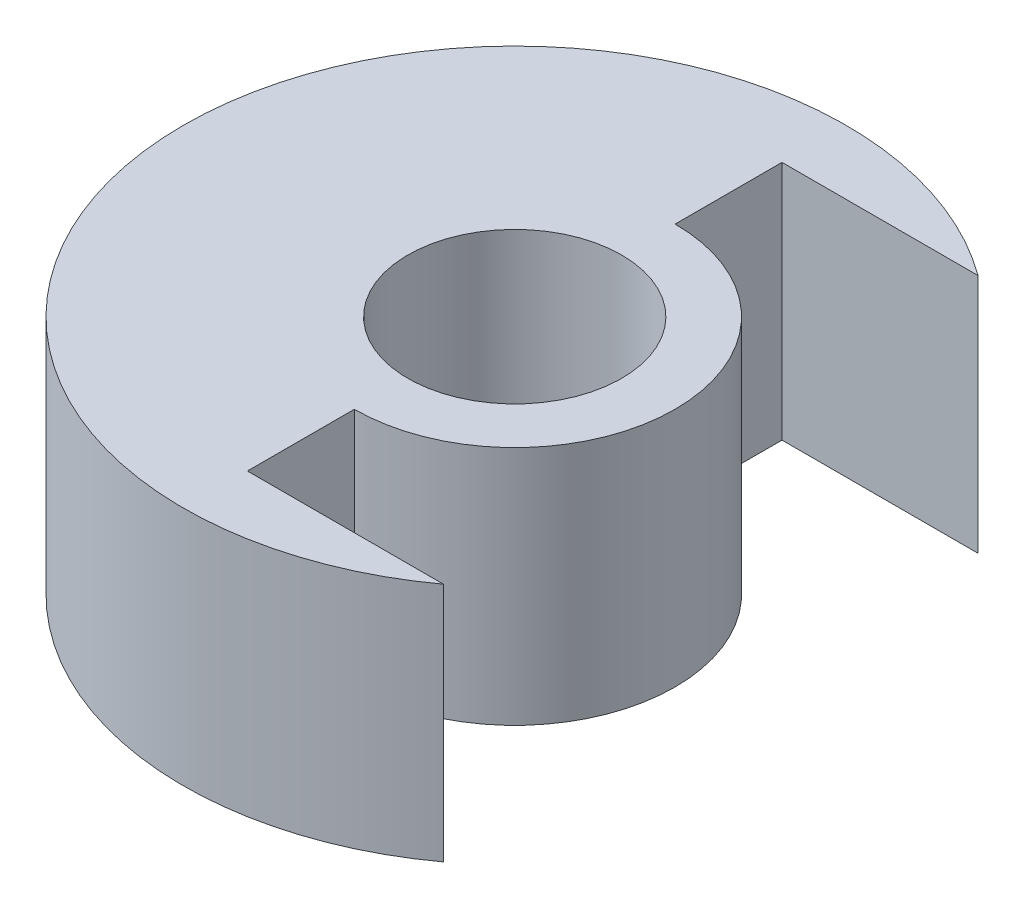
from build123d import *

# Parameters (mm, degrees)
CROQUIS1_R              = 62
SALIENTE_EXTRUIR1_DEPTH = 45
CROQUIS3_R              = 23.5
CORTAR_EXTRUIR1_DEPTH   = 8
CROQUIS4_R              = 20
CORTAR_EXTRUIR2_DEPTH   = 99.554553421
CORTAR_EXTRUIR3_DEPTH   = 99.554553421


with BuildPart() as part:
    # Croquis1 → Saliente-Extruir1 (new body)
    with BuildSketch(Plane(origin=(0, 0, 0), x_dir=(1, 0, 0), z_dir=(0, 1, 0))):
        Circle(CROQUIS1_R)
    extrude(amount=SALIENTE_EXTRUIR1_DEPTH)

    # Croquis3 → Cortar-Extruir1 (cut)
    with BuildSketch(Plane.XZ):
        Circle(CROQUIS3_R)
    extrude(amount=-CORTAR_EXTRUIR1_DEPTH, mode=Mode.SUBTRACT)

    # Croquis4 → Cortar-Extruir2 (cut, through all)
    with BuildSketch(Plane.XZ):
        Circle(CROQUIS4_R)
    extrude(amount=-CORTAR_EXTRUIR2_DEPTH, mode=Mode.SUBTRACT)

    # Croquis5 → Cortar-Extruir3 (cut, through all)
    with BuildSketch(Plane.XZ):
        with BuildLine():
            Line((0, 30), (0, 50))
            Line((0, 50), (36.66060556, 50))
            Line((36.66060556, 50), (110, 15))
            Line((110, 15), (110, -15))
            Line((110, -15), (36.66060556, -50))
            Line((36.66060556, -50), (0, -50))
            Line((0, -50), (0, -30))
            ThreePointArc((0, -30), (30, 0), (0, 30))
        make_face()
    extrude(amount=-CORTAR_EXTRUIR3_DEPTH, mode=Mode.SUBTRACT)


solid = part.part
